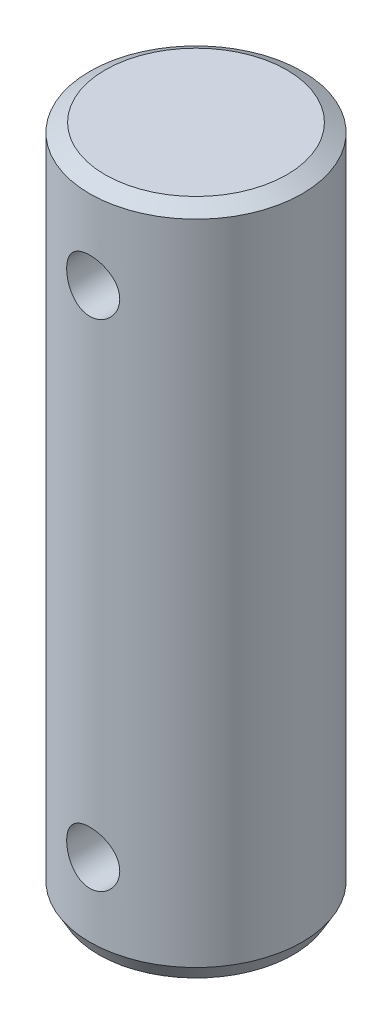
from build123d import *
from OCP.BRepFilletAPI import BRepFilletAPI_MakeChamfer

# Parameters (mm, degrees)
SKETCH1_R           = 6
BOSS_EXTRUDE1_DEPTH = 19
CHAMFER1_SIZE       = 0.5
CHAMFER1_SIZE2      = 0.866025404
SKETCH2_R           = 1.5
CUT_EXTRUDE1_DEPTH  = 24


with BuildPart() as part:
    # Sketch1 → Boss-Extrude1 (new, symmetric)
    with BuildSketch(Plane(origin=(0, 0, 0), x_dir=(1, 0, 0), z_dir=(0, 1, 0))):
        with Locations(Location((0, 0, 0), (0, 0, 270))):
            Circle(SKETCH1_R)
    extrude(amount=BOSS_EXTRUDE1_DEPTH, both=True)

    # Chamfer1: one chamfer whose edges measure the first distance from different faces: ONE call of the kernel's chamfer builder (chamfer() names one face for all edges)
    chamfer1_edges_1 = [part.edges().sort_by_distance(p)[0] for p in [
        (0, -19, -6),
    ]]
    chamfer1_side_1 = [part.faces().sort_by_distance(p)[0] for p in [
        (0, -19, 0),
    ]]
    chamfer1_edges_2 = [part.edges().sort_by_distance(p)[0] for p in [
        (0, 19, -6),
    ]]
    chamfer1_side_2 = [part.faces().sort_by_distance(p)[0] for p in [
        (0, 0, -6),
    ]]
    chamfer1 = BRepFilletAPI_MakeChamfer(part.part.solid().wrapped)
    for e in chamfer1_edges_1:
        chamfer1.Add(CHAMFER1_SIZE, CHAMFER1_SIZE2, e.wrapped, chamfer1_side_1[0].wrapped)  # the first distance lies on this face
    for e in chamfer1_edges_2:
        chamfer1.Add(CHAMFER1_SIZE, CHAMFER1_SIZE2, e.wrapped, chamfer1_side_2[0].wrapped)  # the first distance lies on this face
    add(Compound.cast(chamfer1.Shape()), mode=Mode.REPLACE)

    # Sketch2 → Cut-Extrude1 (cut, symmetric)
    with BuildSketch(Plane.XY):
        with Locations(Location((0, 14, 0), (0, 0, 90.000000004))):
            Circle(SKETCH2_R)
        with Locations(Location((0, -14, 0), (0, 0, 90.000000004))):
            Circle(SKETCH2_R)
    extrude(amount=CUT_EXTRUDE1_DEPTH, both=True, mode=Mode.SUBTRACT)


solid = part.part
